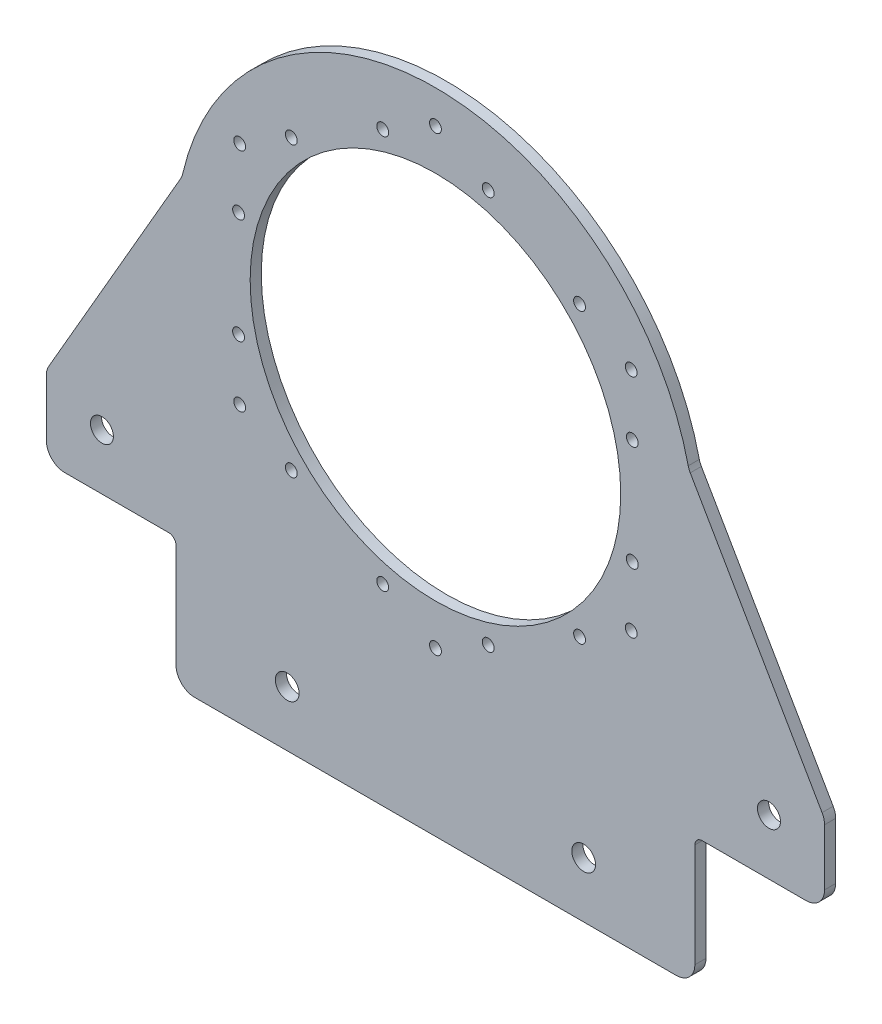
from build123d import *

# Parameters (mm, degrees)
SKETCH1_R           = 50
BOSS_EXTRUDE1_DEPTH = 3
SKETCH2_R           = 1.6
CUT_EXTRUDE1_DEPTH  = 100.040395799
SKETCH3_R           = 1.6
CUT_EXTRUDE2_DEPTH  = 100.040395799
BOSS_EXTRUDE2_START = -3
SKETCH4_R           = 3.1
SKETCH4_W           = 140
SKETCH4_H           = 35
SKETCH4_R_2         = 3.2
BOSS_EXTRUDE2_DEPTH = 3
FILLET1_R           = 5
FILLET2_R           = 2


with BuildPart() as part:
    # Sketch1 → Boss-Extrude1 (new body)
    with BuildSketch(Plane.XY):
        with BuildLine():
            Line((-70, 0), (-70, -70))
            Line((-70, -70), (70, -70))
            Line((70, -70), (70, 0))
            ThreePointArc((70, 0), (0, 70), (-70, 0))
        make_face()
        Circle(SKETCH1_R, mode=Mode.SUBTRACT)
    extrude(amount=BOSS_EXTRUDE1_DEPTH)

    # Sketch2 → Cut-Extrude1 (cut, through all)
    with BuildSketch(Plane.XY.offset(3)):
        with Locations((0, 61)):
            Circle(SKETCH2_R)
        with Locations((52.827549631, 30.5)):
            Circle(SKETCH2_R)
        with Locations((52.827549631, -30.5)):
            Circle(SKETCH2_R)
        with Locations((0, -61)):
            Circle(SKETCH2_R)
        with Locations((-52.827549631, -30.5)):
            Circle(SKETCH2_R)
        with Locations((-52.827549631, 30.5)):
            Circle(SKETCH2_R)
    extrude(amount=-CUT_EXTRUDE1_DEPTH, mode=Mode.SUBTRACT)

    # Sketch3 → Cut-Extrude2 (cut, through all)
    with BuildSketch(Plane.XY.offset(3)):
        with Locations((14.235047481, 53.125920446)):
            Circle(SKETCH3_R)
        with Locations((38.890872965, 38.890872965)):
            Circle(SKETCH3_R)
        with Locations((53.125920446, 14.235047481)):
            Circle(SKETCH3_R)
        with Locations((53.125920446, -14.235047481)):
            Circle(SKETCH3_R)
        with Locations((38.890872965, -38.890872965)):
            Circle(SKETCH3_R)
        with Locations((14.235047481, -53.125920446)):
            Circle(SKETCH3_R)
        with Locations((-14.235047481, -53.125920446)):
            Circle(SKETCH3_R)
        with Locations((-38.890872965, -38.890872965)):
            Circle(SKETCH3_R)
        with Locations((-53.125920446, -14.235047481)):
            Circle(SKETCH3_R)
        with Locations((-53.125920446, 14.235047481)):
            Circle(SKETCH3_R)
        with Locations((-38.890872965, 38.890872965)):
            Circle(SKETCH3_R)
        with Locations((-14.235047481, 53.125920446)):
            Circle(SKETCH3_R)
    extrude(amount=-CUT_EXTRUDE2_DEPTH, mode=Mode.SUBTRACT)

    # Sketch4 → Boss-Extrude2 (add)
    # profile 1 of 3: a face of its own
    with BuildSketch(Plane.XY.offset(3).offset(BOSS_EXTRUDE2_START)):
        with BuildLine():
            ThreePointArc((-70, 0), (-69.592305666, 7.543937436), (-68.373971656, 15))
            Line((-68.373971656, 15), (-105, -48.438141971))
            Line((-105, -48.438141971), (-105, -70))
            Line((-105, -70), (-70, -70))
            Line((-70, -70), (-70, 0))
        make_face()
        with Locations((-90, -55)):
            Circle(SKETCH4_R, mode=Mode.SUBTRACT)
    # profile 2 of 3: a face of its own
    with BuildSketch(Plane.XY.offset(3).offset(BOSS_EXTRUDE2_START)):
        with BuildLine():
            Line((105, -48.438141971), (68.373971656, 15))
            ThreePointArc((68.373971656, 15), (69.592305666, 7.543937436), (70, 0))
            Line((70, 0), (70, -70))
            Line((70, -70), (105, -70))
            Line((105, -70), (105, -48.438141971))
        make_face()
        with Locations((90, -55)):
            Circle(SKETCH4_R, mode=Mode.SUBTRACT)
    # profile 3 of 3: a face of its own
    with BuildSketch(Plane.XY.offset(3).offset(BOSS_EXTRUDE2_START)):
        with Locations((0, -87.5)):
            Rectangle(SKETCH4_W, SKETCH4_H)
        with Locations((-40, -90)):
            Circle(SKETCH4_R_2, mode=Mode.SUBTRACT)
        with Locations((40, -90)):
            Circle(SKETCH4_R_2, mode=Mode.SUBTRACT)
    extrude(amount=BOSS_EXTRUDE2_DEPTH)

    # Fillet1
    fillet1_edges = [part.edges().sort_by_distance(p)[0] for p in [
        (-105, -70, 1.5),
        (-105, -48.438141971, 1.5),
        (-68.373971656, 15, 1.5),
        (68.373971656, 15, 1.5),
        (105, -48.438141971, 1.5),
        (105, -70, 1.5),
        (-70, -105, 1.5),
        (70, -105, 1.5),
    ]]
    fillet(fillet1_edges, radius=FILLET1_R)

    # Fillet2
    fillet2_edges = [part.edges().sort_by_distance(p)[0] for p in [
        (-70, -70, 1.5),
        (70, -70, 1.5),
    ]]
    fillet(fillet2_edges, radius=FILLET2_R)


solid = part.part
